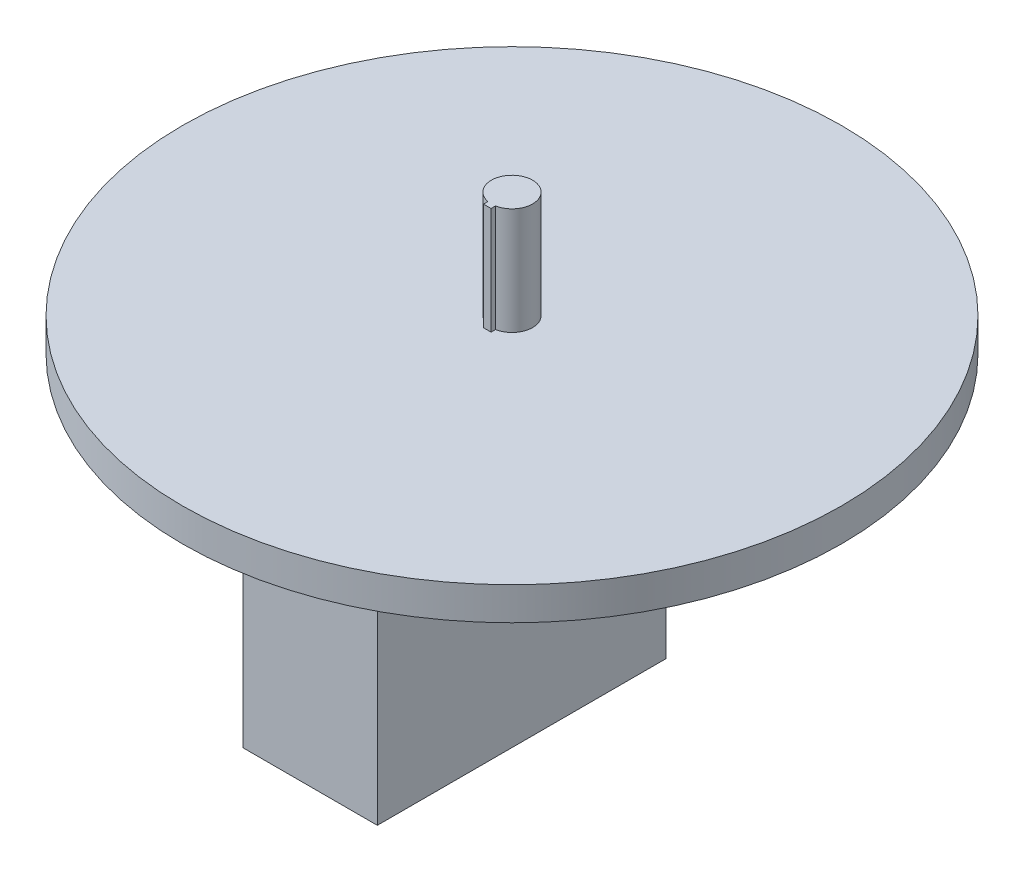
from build123d import *

# Parameters (mm, degrees)
SKETCH1_R           = 400
BOSS_EXTRUDE1_DEPTH = 10
BOSS_EXTRUDE5_DEPTH = 130
BOSS_EXTRUDE6_START = -30
SKETCH1_4_R         = 400
BOSS_EXTRUDE6_DEPTH = 30
SKETCH4_W           = 162.910444241
SKETCH4_H           = 350.538335194
BOSS_EXTRUDE7_DEPTH = 450


with BuildPart() as part:
    # Sketch1 → Boss-Extrude1 (new body)
    with BuildSketch(Plane(origin=(0, 0, 0), x_dir=(1, 0, 0), z_dir=(0, 1, 0))):
        Circle(SKETCH1_R)
    extrude(amount=BOSS_EXTRUDE1_DEPTH)

    # Sketch3 → Boss-Extrude5 (add)
    with BuildSketch(Plane(origin=(0, 10, 0), x_dir=(1, 0, 0), z_dir=(0, 1, 0))):
        with BuildLine():
            Line((-4.6, -30.015), (4.6, -30.015))
            Line((4.6, -30.015), (4.6, -24.573156085))
            ThreePointArc((4.6, -24.573156085), (0, 25), (-4.6, -24.573156085))
            Line((-4.6, -24.573156085), (-4.6, -30.015))
        make_face()
    extrude(amount=BOSS_EXTRUDE5_DEPTH)

    # Sketch1<4> → Boss-Extrude6 (add)
    with BuildSketch(Plane(origin=(0, 0, 0), x_dir=(1, 0, 0), z_dir=(0, 1, 0)).offset(BOSS_EXTRUDE6_START)):
        Circle(SKETCH1_4_R)
    extrude(amount=BOSS_EXTRUDE6_DEPTH)

    # Sketch4 → Boss-Extrude7 (add)
    with BuildSketch(Plane.XZ.offset(30)):
        with Locations((-117.407871884, -47.749612967)):
            Rectangle(SKETCH4_W, SKETCH4_H)
    extrude(amount=BOSS_EXTRUDE7_DEPTH)


solid = part.part
